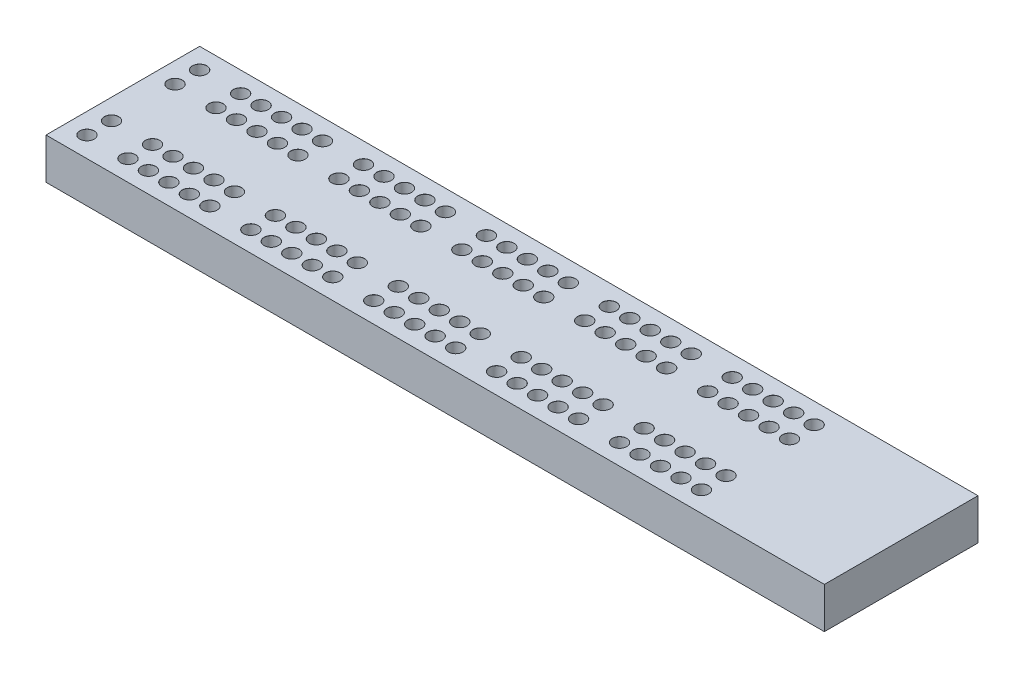
from build123d import *

# Parameters (mm, degrees)
SKETCH1_W            = 380
SKETCH1_H            = 75
BOSS_EXTRUDE1_DEPTH  = 20
LPATTERN1_COUNT      = 31
LPATTERN1_PITCH      = 10
LPATTERN1_COUNT_DIR2 = 2
LPATTERN1_PITCH_DIR2 = 12


with BuildPart() as part:
    # Sketch1 → Boss-Extrude1 (new body)
    with BuildSketch(Plane(origin=(0, 0, 0), x_dir=(1, 0, 0), z_dir=(0, 1, 0))):
        Rectangle(SKETCH1_W, SKETCH1_H)
    extrude(amount=BOSS_EXTRUDE1_DEPTH)

    # Sketch3 → Ø7.0 (7) Diameter Hole1 (revolve, cut)
    with BuildSketch(Plane(origin=(-180, 20, -27.5), x_dir=(0, 0, 1), z_dir=(1, 0, 0))):
        Polygon((0, 0), (0, 14.103012167), (3.5, 12), (3.5, 0.025), (3.525, 0), align=None)
    f_7_0_7_diameter_hole1 = revolve(axis=Axis((-180, 26.35, -27.5), (0, -1, 0)), mode=Mode.SUBTRACT)

    # LPattern1: 7.0 _7_ Diameter Hole1 31 × 2, 10 skipped
    with Locations(*[(i * LPATTERN1_PITCH, 0, j * LPATTERN1_PITCH_DIR2) for i in range(LPATTERN1_COUNT) for j in range(LPATTERN1_COUNT_DIR2) if (i, j) not in ((0, 0), (1, 0), (1, 1), (7, 0), (7, 1), (13, 0), (13, 1), (19, 0), (19, 1), (25, 0), (25, 1))]):
        add(f_7_0_7_diameter_hole1, mode=Mode.SUBTRACT)

    # Mirror1: Ø7.0 (7) Diameter Hole1 across plane
    add(f_7_0_7_diameter_hole1.mirror(Plane.XY), mode=Mode.SUBTRACT)

    # Mirror1 copy 1 sketch → Mirror1 copy 1 (revolve, cut)
    with BuildSketch(Plane(origin=(-180, 20, 15.5), x_dir=(0, 0, -1), z_dir=(1, 0, 0))):
        Polygon((0, 0), (0, -14.103012167), (3.5, -12), (3.5, -0.025), (3.525, 0), align=None)
    revolve(axis=Axis((-180, 26.35, 15.5), (0, 1, 0)), mode=Mode.SUBTRACT)

    # Mirror1 copy 2 sketch → Mirror1 copy 2 (revolve, cut)
    with BuildSketch(Plane(origin=(-160, 20, 27.5), x_dir=(0, 0, -1), z_dir=(1, 0, 0))):
        Polygon((0, 0), (0, -14.103012167), (3.5, -12), (3.5, -0.025), (3.525, 0), align=None)
    revolve(axis=Axis((-160, 26.35, 27.5), (0, 1, 0)), mode=Mode.SUBTRACT)

    # Mirror1 copy 3 sketch → Mirror1 copy 3 (revolve, cut)
    with BuildSketch(Plane(origin=(-160, 20, 15.5), x_dir=(0, 0, -1), z_dir=(1, 0, 0))):
        Polygon((0, 0), (0, -14.103012167), (3.5, -12), (3.5, -0.025), (3.525, 0), align=None)
    revolve(axis=Axis((-160, 26.35, 15.5), (0, 1, 0)), mode=Mode.SUBTRACT)

    # Mirror1 copy 4 sketch → Mirror1 copy 4 (revolve, cut)
    with BuildSketch(Plane(origin=(-150, 20, 27.5), x_dir=(0, 0, -1), z_dir=(1, 0, 0))):
        Polygon((0, 0), (0, -14.103012167), (3.5, -12), (3.5, -0.025), (3.525, 0), align=None)
    revolve(axis=Axis((-150, 26.35, 27.5), (0, 1, 0)), mode=Mode.SUBTRACT)

    # Mirror1 copy 5 sketch → Mirror1 copy 5 (revolve, cut)
    with BuildSketch(Plane(origin=(-150, 20, 15.5), x_dir=(0, 0, -1), z_dir=(1, 0, 0))):
        Polygon((0, 0), (0, -14.103012167), (3.5, -12), (3.5, -0.025), (3.525, 0), align=None)
    revolve(axis=Axis((-150, 26.35, 15.5), (0, 1, 0)), mode=Mode.SUBTRACT)

    # Mirror1 copy 6 sketch → Mirror1 copy 6 (revolve, cut)
    with BuildSketch(Plane(origin=(-140, 20, 27.5), x_dir=(0, 0, -1), z_dir=(1, 0, 0))):
        Polygon((0, 0), (0, -14.103012167), (3.5, -12), (3.5, -0.025), (3.525, 0), align=None)
    revolve(axis=Axis((-140, 26.35, 27.5), (0, 1, 0)), mode=Mode.SUBTRACT)

    # Mirror1 copy 7 sketch → Mirror1 copy 7 (revolve, cut)
    with BuildSketch(Plane(origin=(-140, 20, 15.5), x_dir=(0, 0, -1), z_dir=(1, 0, 0))):
        Polygon((0, 0), (0, -14.103012167), (3.5, -12), (3.5, -0.025), (3.525, 0), align=None)
    revolve(axis=Axis((-140, 26.35, 15.5), (0, 1, 0)), mode=Mode.SUBTRACT)

    # Mirror1 copy 8 sketch → Mirror1 copy 8 (revolve, cut)
    with BuildSketch(Plane(origin=(-130, 20, 27.5), x_dir=(0, 0, -1), z_dir=(1, 0, 0))):
        Polygon((0, 0), (0, -14.103012167), (3.5, -12), (3.5, -0.025), (3.525, 0), align=None)
    revolve(axis=Axis((-130, 26.35, 27.5), (0, 1, 0)), mode=Mode.SUBTRACT)

    # Mirror1 copy 9 sketch → Mirror1 copy 9 (revolve, cut)
    with BuildSketch(Plane(origin=(-130, 20, 15.5), x_dir=(0, 0, -1), z_dir=(1, 0, 0))):
        Polygon((0, 0), (0, -14.103012167), (3.5, -12), (3.5, -0.025), (3.525, 0), align=None)
    revolve(axis=Axis((-130, 26.35, 15.5), (0, 1, 0)), mode=Mode.SUBTRACT)

    # Mirror1 copy 10 sketch → Mirror1 copy 10 (revolve, cut)
    with BuildSketch(Plane(origin=(-120, 20, 27.5), x_dir=(0, 0, -1), z_dir=(1, 0, 0))):
        Polygon((0, 0), (0, -14.103012167), (3.5, -12), (3.5, -0.025), (3.525, 0), align=None)
    revolve(axis=Axis((-120, 26.35, 27.5), (0, 1, 0)), mode=Mode.SUBTRACT)

    # Mirror1 copy 11 sketch → Mirror1 copy 11 (revolve, cut)
    with BuildSketch(Plane(origin=(-120, 20, 15.5), x_dir=(0, 0, -1), z_dir=(1, 0, 0))):
        Polygon((0, 0), (0, -14.103012167), (3.5, -12), (3.5, -0.025), (3.525, 0), align=None)
    revolve(axis=Axis((-120, 26.35, 15.5), (0, 1, 0)), mode=Mode.SUBTRACT)

    # Mirror1 copy 12 sketch → Mirror1 copy 12 (revolve, cut)
    with BuildSketch(Plane(origin=(-100, 20, 27.5), x_dir=(0, 0, -1), z_dir=(1, 0, 0))):
        Polygon((0, 0), (0, -14.103012167), (3.5, -12), (3.5, -0.025), (3.525, 0), align=None)
    revolve(axis=Axis((-100, 26.35, 27.5), (0, 1, 0)), mode=Mode.SUBTRACT)

    # Mirror1 copy 13 sketch → Mirror1 copy 13 (revolve, cut)
    with BuildSketch(Plane(origin=(-100, 20, 15.5), x_dir=(0, 0, -1), z_dir=(1, 0, 0))):
        Polygon((0, 0), (0, -14.103012167), (3.5, -12), (3.5, -0.025), (3.525, 0), align=None)
    revolve(axis=Axis((-100, 26.35, 15.5), (0, 1, 0)), mode=Mode.SUBTRACT)

    # Mirror1 copy 14 sketch → Mirror1 copy 14 (revolve, cut)
    with BuildSketch(Plane(origin=(-90, 20, 27.5), x_dir=(0, 0, -1), z_dir=(1, 0, 0))):
        Polygon((0, 0), (0, -14.103012167), (3.5, -12), (3.5, -0.025), (3.525, 0), align=None)
    revolve(axis=Axis((-90, 26.35, 27.5), (0, 1, 0)), mode=Mode.SUBTRACT)

    # Mirror1 copy 15 sketch → Mirror1 copy 15 (revolve, cut)
    with BuildSketch(Plane(origin=(-90, 20, 15.5), x_dir=(0, 0, -1), z_dir=(1, 0, 0))):
        Polygon((0, 0), (0, -14.103012167), (3.5, -12), (3.5, -0.025), (3.525, 0), align=None)
    revolve(axis=Axis((-90, 26.35, 15.5), (0, 1, 0)), mode=Mode.SUBTRACT)

    # Mirror1 copy 16 sketch → Mirror1 copy 16 (revolve, cut)
    with BuildSketch(Plane(origin=(-80, 20, 27.5), x_dir=(0, 0, -1), z_dir=(1, 0, 0))):
        Polygon((0, 0), (0, -14.103012167), (3.5, -12), (3.5, -0.025), (3.525, 0), align=None)
    revolve(axis=Axis((-80, 26.35, 27.5), (0, 1, 0)), mode=Mode.SUBTRACT)

    # Mirror1 copy 17 sketch → Mirror1 copy 17 (revolve, cut)
    with BuildSketch(Plane(origin=(-80, 20, 15.5), x_dir=(0, 0, -1), z_dir=(1, 0, 0))):
        Polygon((0, 0), (0, -14.103012167), (3.5, -12), (3.5, -0.025), (3.525, 0), align=None)
    revolve(axis=Axis((-80, 26.35, 15.5), (0, 1, 0)), mode=Mode.SUBTRACT)

    # Mirror1 copy 18 sketch → Mirror1 copy 18 (revolve, cut)
    with BuildSketch(Plane(origin=(-70, 20, 27.5), x_dir=(0, 0, -1), z_dir=(1, 0, 0))):
        Polygon((0, 0), (0, -14.103012167), (3.5, -12), (3.5, -0.025), (3.525, 0), align=None)
    revolve(axis=Axis((-70, 26.35, 27.5), (0, 1, 0)), mode=Mode.SUBTRACT)

    # Mirror1 copy 19 sketch → Mirror1 copy 19 (revolve, cut)
    with BuildSketch(Plane(origin=(-70, 20, 15.5), x_dir=(0, 0, -1), z_dir=(1, 0, 0))):
        Polygon((0, 0), (0, -14.103012167), (3.5, -12), (3.5, -0.025), (3.525, 0), align=None)
    revolve(axis=Axis((-70, 26.35, 15.5), (0, 1, 0)), mode=Mode.SUBTRACT)

    # Mirror1 copy 20 sketch → Mirror1 copy 20 (revolve, cut)
    with BuildSketch(Plane(origin=(-60, 20, 27.5), x_dir=(0, 0, -1), z_dir=(1, 0, 0))):
        Polygon((0, 0), (0, -14.103012167), (3.5, -12), (3.5, -0.025), (3.525, 0), align=None)
    revolve(axis=Axis((-60, 26.35, 27.5), (0, 1, 0)), mode=Mode.SUBTRACT)

    # Mirror1 copy 21 sketch → Mirror1 copy 21 (revolve, cut)
    with BuildSketch(Plane(origin=(-60, 20, 15.5), x_dir=(0, 0, -1), z_dir=(1, 0, 0))):
        Polygon((0, 0), (0, -14.103012167), (3.5, -12), (3.5, -0.025), (3.525, 0), align=None)
    revolve(axis=Axis((-60, 26.35, 15.5), (0, 1, 0)), mode=Mode.SUBTRACT)

    # Mirror1 copy 22 sketch → Mirror1 copy 22 (revolve, cut)
    with BuildSketch(Plane(origin=(-40, 20, 27.5), x_dir=(0, 0, -1), z_dir=(1, 0, 0))):
        Polygon((0, 0), (0, -14.103012167), (3.5, -12), (3.5, -0.025), (3.525, 0), align=None)
    revolve(axis=Axis((-40, 26.35, 27.5), (0, 1, 0)), mode=Mode.SUBTRACT)

    # Mirror1 copy 23 sketch → Mirror1 copy 23 (revolve, cut)
    with BuildSketch(Plane(origin=(-40, 20, 15.5), x_dir=(0, 0, -1), z_dir=(1, 0, 0))):
        Polygon((0, 0), (0, -14.103012167), (3.5, -12), (3.5, -0.025), (3.525, 0), align=None)
    revolve(axis=Axis((-40, 26.35, 15.5), (0, 1, 0)), mode=Mode.SUBTRACT)

    # Mirror1 copy 24 sketch → Mirror1 copy 24 (revolve, cut)
    with BuildSketch(Plane(origin=(-30, 20, 27.5), x_dir=(0, 0, -1), z_dir=(1, 0, 0))):
        Polygon((0, 0), (0, -14.103012167), (3.5, -12), (3.5, -0.025), (3.525, 0), align=None)
    revolve(axis=Axis((-30, 26.35, 27.5), (0, 1, 0)), mode=Mode.SUBTRACT)

    # Mirror1 copy 25 sketch → Mirror1 copy 25 (revolve, cut)
    with BuildSketch(Plane(origin=(-30, 20, 15.5), x_dir=(0, 0, -1), z_dir=(1, 0, 0))):
        Polygon((0, 0), (0, -14.103012167), (3.5, -12), (3.5, -0.025), (3.525, 0), align=None)
    revolve(axis=Axis((-30, 26.35, 15.5), (0, 1, 0)), mode=Mode.SUBTRACT)

    # Mirror1 copy 26 sketch → Mirror1 copy 26 (revolve, cut)
    with BuildSketch(Plane(origin=(-20, 20, 27.5), x_dir=(0, 0, -1), z_dir=(1, 0, 0))):
        Polygon((0, 0), (0, -14.103012167), (3.5, -12), (3.5, -0.025), (3.525, 0), align=None)
    revolve(axis=Axis((-20, 26.35, 27.5), (0, 1, 0)), mode=Mode.SUBTRACT)

    # Mirror1 copy 27 sketch → Mirror1 copy 27 (revolve, cut)
    with BuildSketch(Plane(origin=(-20, 20, 15.5), x_dir=(0, 0, -1), z_dir=(1, 0, 0))):
        Polygon((0, 0), (0, -14.103012167), (3.5, -12), (3.5, -0.025), (3.525, 0), align=None)
    revolve(axis=Axis((-20, 26.35, 15.5), (0, 1, 0)), mode=Mode.SUBTRACT)

    # Mirror1 copy 28 sketch → Mirror1 copy 28 (revolve, cut)
    with BuildSketch(Plane(origin=(-10, 20, 27.5), x_dir=(0, 0, -1), z_dir=(1, 0, 0))):
        Polygon((0, 0), (0, -14.103012167), (3.5, -12), (3.5, -0.025), (3.525, 0), align=None)
    revolve(axis=Axis((-10, 26.35, 27.5), (0, 1, 0)), mode=Mode.SUBTRACT)

    # Mirror1 copy 29 sketch → Mirror1 copy 29 (revolve, cut)
    with BuildSketch(Plane(origin=(-10, 20, 15.5), x_dir=(0, 0, -1), z_dir=(1, 0, 0))):
        Polygon((0, 0), (0, -14.103012167), (3.5, -12), (3.5, -0.025), (3.525, 0), align=None)
    revolve(axis=Axis((-10, 26.35, 15.5), (0, 1, 0)), mode=Mode.SUBTRACT)

    # Mirror1 copy 30 sketch → Mirror1 copy 30 (revolve, cut)
    with BuildSketch(Plane(origin=(0, 20, 27.5), x_dir=(0, 0, -1), z_dir=(1, 0, 0))):
        Polygon((0, 0), (0, -14.103012167), (3.5, -12), (3.5, -0.025), (3.525, 0), align=None)
    revolve(axis=Axis((0, 26.35, 27.5), (0, 1, 0)), mode=Mode.SUBTRACT)

    # Mirror1 copy 31 sketch → Mirror1 copy 31 (revolve, cut)
    with BuildSketch(Plane(origin=(0, 20, 15.5), x_dir=(0, 0, -1), z_dir=(1, 0, 0))):
        Polygon((0, 0), (0, -14.103012167), (3.5, -12), (3.5, -0.025), (3.525, 0), align=None)
    revolve(axis=Axis((0, 26.35, 15.5), (0, 1, 0)), mode=Mode.SUBTRACT)

    # Mirror1 copy 32 sketch → Mirror1 copy 32 (revolve, cut)
    with BuildSketch(Plane(origin=(20, 20, 27.5), x_dir=(0, 0, -1), z_dir=(1, 0, 0))):
        Polygon((0, 0), (0, -14.103012167), (3.5, -12), (3.5, -0.025), (3.525, 0), align=None)
    revolve(axis=Axis((20, 26.35, 27.5), (0, 1, 0)), mode=Mode.SUBTRACT)

    # Mirror1 copy 33 sketch → Mirror1 copy 33 (revolve, cut)
    with BuildSketch(Plane(origin=(20, 20, 15.5), x_dir=(0, 0, -1), z_dir=(1, 0, 0))):
        Polygon((0, 0), (0, -14.103012167), (3.5, -12), (3.5, -0.025), (3.525, 0), align=None)
    revolve(axis=Axis((20, 26.35, 15.5), (0, 1, 0)), mode=Mode.SUBTRACT)

    # Mirror1 copy 34 sketch → Mirror1 copy 34 (revolve, cut)
    with BuildSketch(Plane(origin=(30, 20, 27.5), x_dir=(0, 0, -1), z_dir=(1, 0, 0))):
        Polygon((0, 0), (0, -14.103012167), (3.5, -12), (3.5, -0.025), (3.525, 0), align=None)
    revolve(axis=Axis((30, 26.35, 27.5), (0, 1, 0)), mode=Mode.SUBTRACT)

    # Mirror1 copy 35 sketch → Mirror1 copy 35 (revolve, cut)
    with BuildSketch(Plane(origin=(30, 20, 15.5), x_dir=(0, 0, -1), z_dir=(1, 0, 0))):
        Polygon((0, 0), (0, -14.103012167), (3.5, -12), (3.5, -0.025), (3.525, 0), align=None)
    revolve(axis=Axis((30, 26.35, 15.5), (0, 1, 0)), mode=Mode.SUBTRACT)

    # Mirror1 copy 36 sketch → Mirror1 copy 36 (revolve, cut)
    with BuildSketch(Plane(origin=(40, 20, 27.5), x_dir=(0, 0, -1), z_dir=(1, 0, 0))):
        Polygon((0, 0), (0, -14.103012167), (3.5, -12), (3.5, -0.025), (3.525, 0), align=None)
    revolve(axis=Axis((40, 26.35, 27.5), (0, 1, 0)), mode=Mode.SUBTRACT)

    # Mirror1 copy 37 sketch → Mirror1 copy 37 (revolve, cut)
    with BuildSketch(Plane(origin=(40, 20, 15.5), x_dir=(0, 0, -1), z_dir=(1, 0, 0))):
        Polygon((0, 0), (0, -14.103012167), (3.5, -12), (3.5, -0.025), (3.525, 0), align=None)
    revolve(axis=Axis((40, 26.35, 15.5), (0, 1, 0)), mode=Mode.SUBTRACT)

    # Mirror1 copy 38 sketch → Mirror1 copy 38 (revolve, cut)
    with BuildSketch(Plane(origin=(50, 20, 27.5), x_dir=(0, 0, -1), z_dir=(1, 0, 0))):
        Polygon((0, 0), (0, -14.103012167), (3.5, -12), (3.5, -0.025), (3.525, 0), align=None)
    revolve(axis=Axis((50, 26.35, 27.5), (0, 1, 0)), mode=Mode.SUBTRACT)

    # Mirror1 copy 39 sketch → Mirror1 copy 39 (revolve, cut)
    with BuildSketch(Plane(origin=(50, 20, 15.5), x_dir=(0, 0, -1), z_dir=(1, 0, 0))):
        Polygon((0, 0), (0, -14.103012167), (3.5, -12), (3.5, -0.025), (3.525, 0), align=None)
    revolve(axis=Axis((50, 26.35, 15.5), (0, 1, 0)), mode=Mode.SUBTRACT)

    # Mirror1 copy 40 sketch → Mirror1 copy 40 (revolve, cut)
    with BuildSketch(Plane(origin=(60, 20, 27.5), x_dir=(0, 0, -1), z_dir=(1, 0, 0))):
        Polygon((0, 0), (0, -14.103012167), (3.5, -12), (3.5, -0.025), (3.525, 0), align=None)
    revolve(axis=Axis((60, 26.35, 27.5), (0, 1, 0)), mode=Mode.SUBTRACT)

    # Mirror1 copy 41 sketch → Mirror1 copy 41 (revolve, cut)
    with BuildSketch(Plane(origin=(60, 20, 15.5), x_dir=(0, 0, -1), z_dir=(1, 0, 0))):
        Polygon((0, 0), (0, -14.103012167), (3.5, -12), (3.5, -0.025), (3.525, 0), align=None)
    revolve(axis=Axis((60, 26.35, 15.5), (0, 1, 0)), mode=Mode.SUBTRACT)

    # Mirror1 copy 42 sketch → Mirror1 copy 42 (revolve, cut)
    with BuildSketch(Plane(origin=(80, 20, 27.5), x_dir=(0, 0, -1), z_dir=(1, 0, 0))):
        Polygon((0, 0), (0, -14.103012167), (3.5, -12), (3.5, -0.025), (3.525, 0), align=None)
    revolve(axis=Axis((80, 26.35, 27.5), (0, 1, 0)), mode=Mode.SUBTRACT)

    # Mirror1 copy 43 sketch → Mirror1 copy 43 (revolve, cut)
    with BuildSketch(Plane(origin=(80, 20, 15.5), x_dir=(0, 0, -1), z_dir=(1, 0, 0))):
        Polygon((0, 0), (0, -14.103012167), (3.5, -12), (3.5, -0.025), (3.525, 0), align=None)
    revolve(axis=Axis((80, 26.35, 15.5), (0, 1, 0)), mode=Mode.SUBTRACT)

    # Mirror1 copy 44 sketch → Mirror1 copy 44 (revolve, cut)
    with BuildSketch(Plane(origin=(90, 20, 27.5), x_dir=(0, 0, -1), z_dir=(1, 0, 0))):
        Polygon((0, 0), (0, -14.103012167), (3.5, -12), (3.5, -0.025), (3.525, 0), align=None)
    revolve(axis=Axis((90, 26.35, 27.5), (0, 1, 0)), mode=Mode.SUBTRACT)

    # Mirror1 copy 45 sketch → Mirror1 copy 45 (revolve, cut)
    with BuildSketch(Plane(origin=(90, 20, 15.5), x_dir=(0, 0, -1), z_dir=(1, 0, 0))):
        Polygon((0, 0), (0, -14.103012167), (3.5, -12), (3.5, -0.025), (3.525, 0), align=None)
    revolve(axis=Axis((90, 26.35, 15.5), (0, 1, 0)), mode=Mode.SUBTRACT)

    # Mirror1 copy 46 sketch → Mirror1 copy 46 (revolve, cut)
    with BuildSketch(Plane(origin=(100, 20, 27.5), x_dir=(0, 0, -1), z_dir=(1, 0, 0))):
        Polygon((0, 0), (0, -14.103012167), (3.5, -12), (3.5, -0.025), (3.525, 0), align=None)
    revolve(axis=Axis((100, 26.35, 27.5), (0, 1, 0)), mode=Mode.SUBTRACT)

    # Mirror1 copy 47 sketch → Mirror1 copy 47 (revolve, cut)
    with BuildSketch(Plane(origin=(100, 20, 15.5), x_dir=(0, 0, -1), z_dir=(1, 0, 0))):
        Polygon((0, 0), (0, -14.103012167), (3.5, -12), (3.5, -0.025), (3.525, 0), align=None)
    revolve(axis=Axis((100, 26.35, 15.5), (0, 1, 0)), mode=Mode.SUBTRACT)

    # Mirror1 copy 48 sketch → Mirror1 copy 48 (revolve, cut)
    with BuildSketch(Plane(origin=(110, 20, 27.5), x_dir=(0, 0, -1), z_dir=(1, 0, 0))):
        Polygon((0, 0), (0, -14.103012167), (3.5, -12), (3.5, -0.025), (3.525, 0), align=None)
    revolve(axis=Axis((110, 26.35, 27.5), (0, 1, 0)), mode=Mode.SUBTRACT)

    # Mirror1 copy 49 sketch → Mirror1 copy 49 (revolve, cut)
    with BuildSketch(Plane(origin=(110, 20, 15.5), x_dir=(0, 0, -1), z_dir=(1, 0, 0))):
        Polygon((0, 0), (0, -14.103012167), (3.5, -12), (3.5, -0.025), (3.525, 0), align=None)
    revolve(axis=Axis((110, 26.35, 15.5), (0, 1, 0)), mode=Mode.SUBTRACT)

    # Mirror1 copy 50 sketch → Mirror1 copy 50 (revolve, cut)
    with BuildSketch(Plane(origin=(120, 20, 27.5), x_dir=(0, 0, -1), z_dir=(1, 0, 0))):
        Polygon((0, 0), (0, -14.103012167), (3.5, -12), (3.5, -0.025), (3.525, 0), align=None)
    revolve(axis=Axis((120, 26.35, 27.5), (0, 1, 0)), mode=Mode.SUBTRACT)

    # Mirror1 copy 51 sketch → Mirror1 copy 51 (revolve, cut)
    with BuildSketch(Plane(origin=(120, 20, 15.5), x_dir=(0, 0, -1), z_dir=(1, 0, 0))):
        Polygon((0, 0), (0, -14.103012167), (3.5, -12), (3.5, -0.025), (3.525, 0), align=None)
    revolve(axis=Axis((120, 26.35, 15.5), (0, 1, 0)), mode=Mode.SUBTRACT)


solid = part.part
